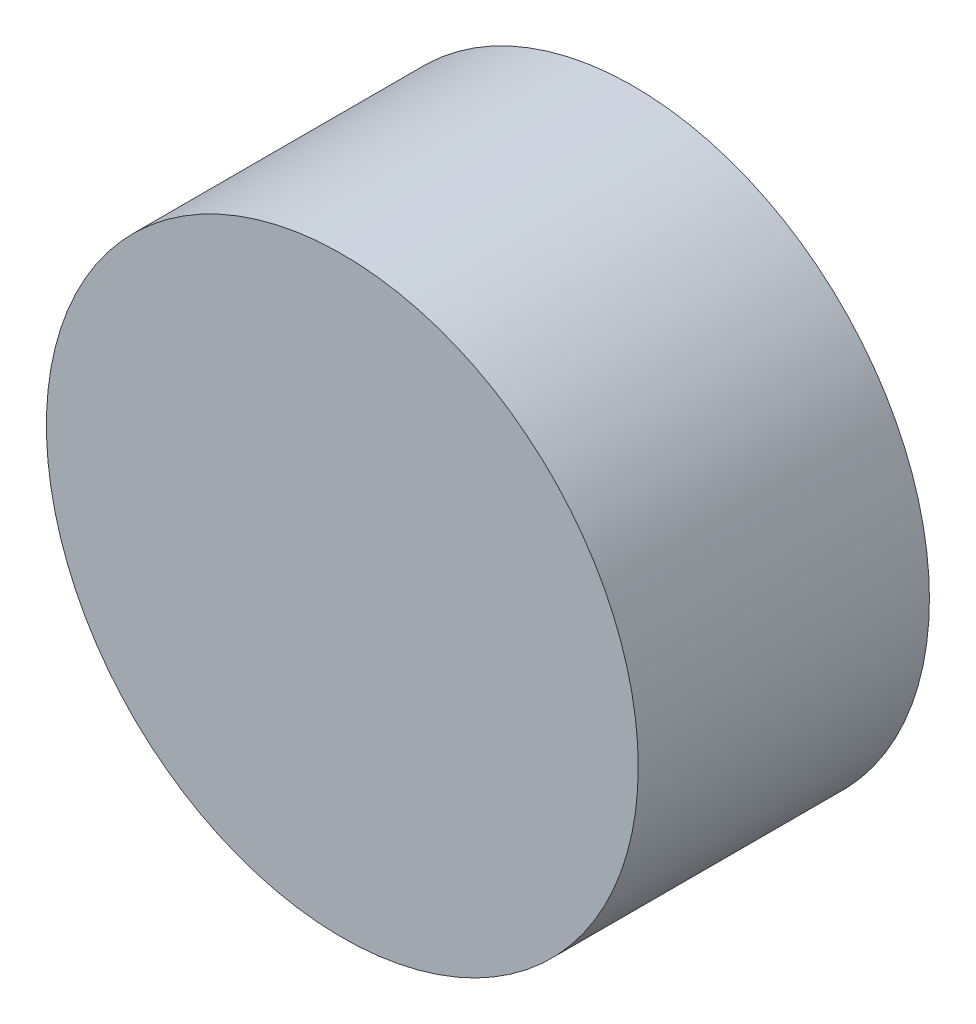
from build123d import *

# Parameters (mm, degrees)
ESQUISSE1_R        = 25
BOSS_EXTRU_1_DEPTH = 24.6


with BuildPart() as part:
    # Esquisse1 → Boss.-Extru.1 (new body)
    with BuildSketch(Plane.XY):
        Circle(ESQUISSE1_R)
    extrude(amount=BOSS_EXTRU_1_DEPTH)


solid = part.part
